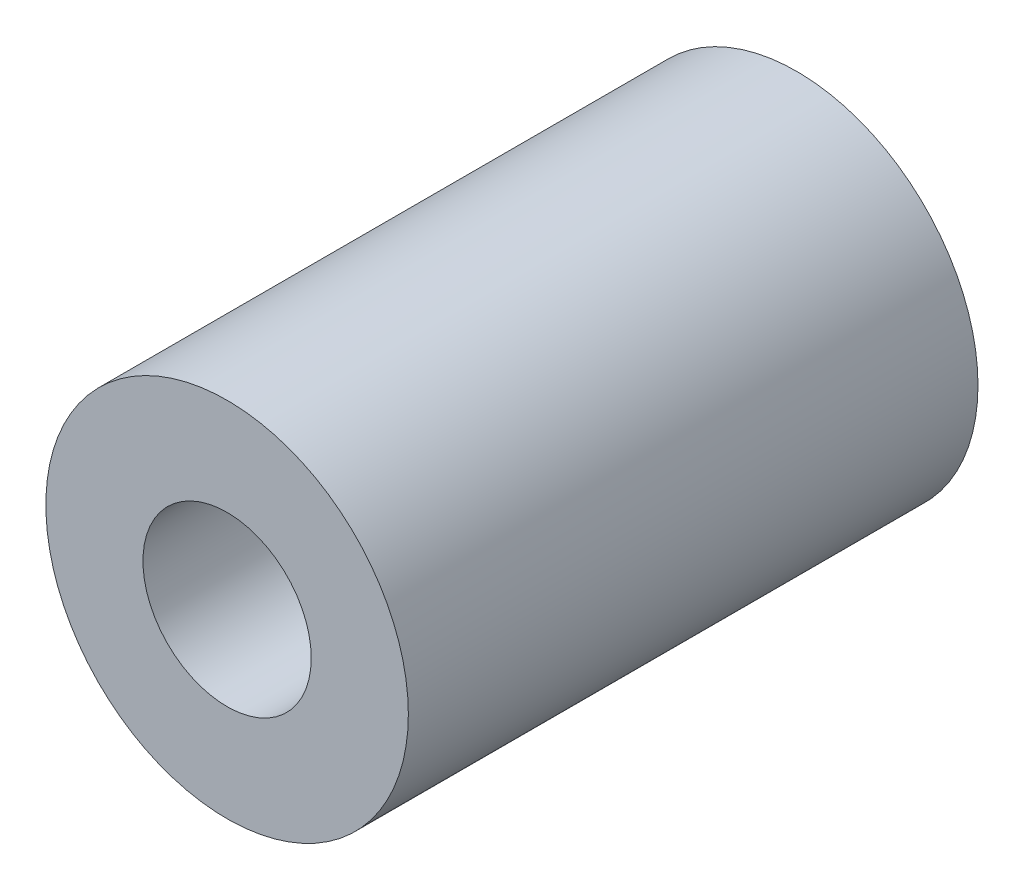
from build123d import *

# Parameters (mm, degrees)
SKETCH1_R               = 7
BOSS_EXTRUDE1_DEPTH     = 11
CUT_EXTRUDE1_DEPTH      = 25.124676164
CUT_EXTRUDE1_DEPTH_BACK = 25.124676164
SKETCH2_R               = 3.25


with BuildPart() as part:
    # Sketch1 → Boss-Extrude1 (new, symmetric)
    with BuildSketch(Plane.XY):
        Circle(SKETCH1_R)
    extrude(amount=BOSS_EXTRUDE1_DEPTH, both=True)

    # Sketch2 → Cut-Extrude1 (cut, two sides: drawn at the far end of the back side and taken through both)
    with BuildSketch(Plane.XY.offset(11).offset(-CUT_EXTRUDE1_DEPTH_BACK)):
        Circle(SKETCH2_R)
    extrude(amount=CUT_EXTRUDE1_DEPTH + CUT_EXTRUDE1_DEPTH_BACK, mode=Mode.SUBTRACT)


solid = part.part
